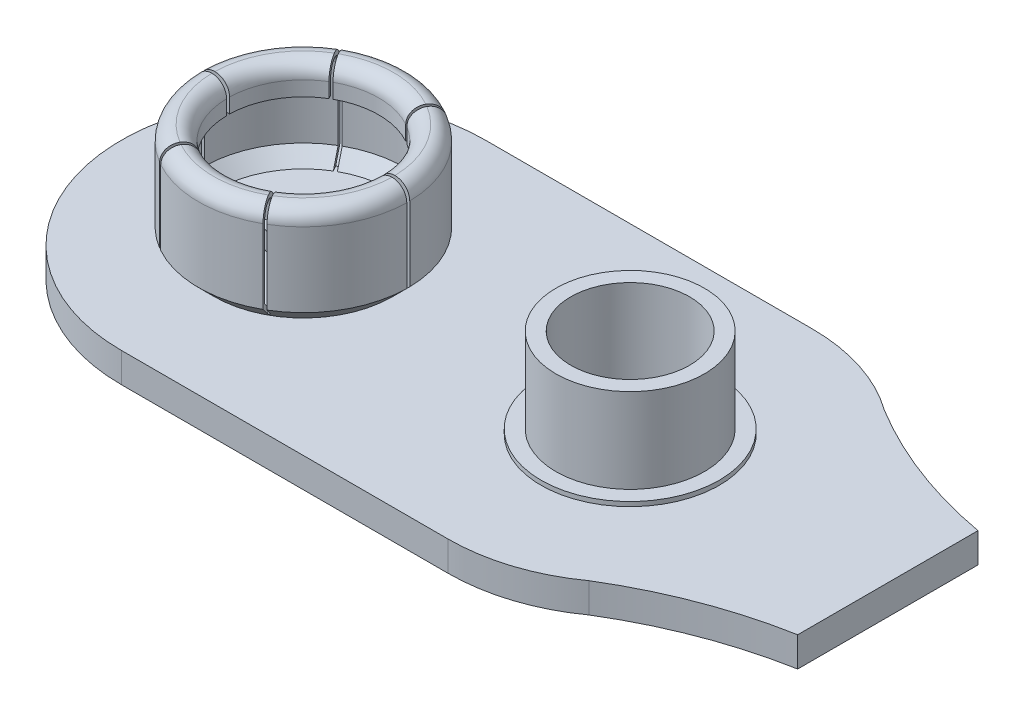
from build123d import *

# Parameters (mm, degrees)
SKETCH2_W           = 25
SKETCH2_H           = 16
BOSS_EXTRUDE1_DEPTH = 46
FILLET1_R           = 4
FILLET2_R           = 1
SKETCH3_R           = 2.5
SKETCH3_R_2         = 2
EXTRUDE_THIN1_DEPTH = 3
SKETCH6_R           = 1
BOSS_EXTRUDE2_DEPTH = 0.75
SKETCH10_W          = 1.5
SKETCH10_H          = 0.1
CUT_EXTRUDE1_DEPTH  = 49.477546349
CIRPATTERN1_COUNT   = 6
SKETCH11_R          = 3
BOSS_EXTRUDE3_DEPTH = 0.15
SKETCH12_W          = 40.346027398
SKETCH12_H          = 30.17682714
CUT_EXTRUDE2_DEPTH  = 46
BOSS_EXTRUDE4_DEPTH = 0.5
BOSS_EXTRUDE5_DEPTH = 0.5
BOSS_EXTRUDE6_DEPTH = 0.5


with BuildPart() as part:
    # Sketch2 → Boss-Extrude1 (new body)
    with BuildSketch(Plane(origin=(0, 0, 0), x_dir=(1, 0, 0), z_dir=(0, 1, 0))):
        Rectangle(SKETCH2_W, SKETCH2_H)
    extrude(amount=BOSS_EXTRUDE1_DEPTH)

    # Fillet1
    fillet1_edges = [part.edges().sort_by_distance(p)[0] for p in [
        (12.5, 23, 8),
        (-12.5, 23, 8),
        (-12.5, 23, -8),
        (12.5, 23, -8),
    ]]
    fillet(fillet1_edges, radius=FILLET1_R)

    # Fillet2
    fillet2_edges = [part.edges().sort_by_distance(p)[0] for p in [
        (-12.5, 0, 0),
        (-12.5, 46, 0),
        (12.5, 0, 0),
        (0, 0, 8),
        (0, 0, -8),
        (11.328427125, 0, 6.828427125),
        (11.328427125, 0, -6.828427125),
        (-11.328427125, 0, 6.828427125),
        (-11.328427125, 0, -6.828427125),
        (0, 46, -8),
        (12.5, 46, 0),
        (0, 46, 8),
        (11.328427125, 46, 6.828427125),
        (11.328427125, 46, -6.828427125),
        (-11.328427125, 46, 6.828427125),
        (-11.328427125, 46, -6.828427125),
    ]]
    fillet(fillet2_edges, radius=FILLET2_R)

    # Sketch3 → Extrude-Thin1 (add)
    with BuildSketch(Plane(origin=(0, 46, 0), x_dir=(1, 0, 0), z_dir=(0, 1, 0))):
        with Locations((5.5, 0)):
            Circle(SKETCH3_R)
        with Locations((5.5, 0)):
            Circle(SKETCH3_R_2, mode=Mode.SUBTRACT)
    extrude(amount=EXTRUDE_THIN1_DEPTH)

    # Sketch6 → Boss-Extrude2 (add)
    with BuildSketch(Plane(origin=(0, 46, 0), x_dir=(1, 0, 0), z_dir=(0, 1, 0))):
        with Locations(Location((-5.5, 0, 0), (0, 0, 90))):
            Circle(SKETCH6_R)
        with Locations(Location((5.5, 0, 0), (0, 0, 90))):
            Circle(SKETCH6_R)
    extrude(amount=BOSS_EXTRUDE2_DEPTH)

    # Sketch9 → Revolve-Thin1 (revolve)
    with BuildSketch(Plane.XY, mode=Mode.PRIVATE) as revolve_thin1_sk:
        with BuildLine():
            Line((-4.5, 46), (-2.5, 46))
            Line((-2.5, 46), (-1.969669914, 46.530330086))
            Line((-1.969669914, 46.530330086), (-1.969669914, 49.030330086))
            ThreePointArc((-1.969669914, 49.030330086), (-2.116202444, 49.381961465), (-2.469074773, 49.525479854))
            ThreePointArc((-2.469074773, 49.525479854), (-2.819198532, 49.380453844), (-2.964224541, 49.030330086))
            Line((-2.964224541, 49.030330086), (-2.964224541, 48.535180318))
            Line((-2.964224541, 48.535180318), (-2.814224541, 48.535180318))
            Line((-2.814224541, 48.535180318), (-2.814224541, 49.030330086))
            ThreePointArc((-2.814224541, 49.030330086), (-2.712905513, 49.274614618), (-2.468433015, 49.375479257))
            ThreePointArc((-2.468433015, 49.375479257), (-2.222041674, 49.27566845), (-2.119669914, 49.030330086))
            Line((-2.119669914, 49.030330086), (-2.119669914, 46.59246212))
            Line((-2.119669914, 46.59246212), (-2.562132034, 46.15))
            Line((-2.562132034, 46.15), (-4.5, 46.15))
            Line((-4.5, 46.15), (-4.5, 46))
        make_face()
    revolve(revolve_thin1_sk.sketch.rotate(Axis((-5.5, 46.75, 0), (0, -1, 0)), 90), axis=Axis((-5.5, 46.75, 0), (0, -1, 0)))

    # Sketch10 → Cut-Extrude1 (cut, through all)
    with BuildSketch(Plane(origin=(0, 46.15, 0), x_dir=(1, 0, 0), z_dir=(0, 1, 0))):
        with Locations((-2.469074773, 0)):
            Rectangle(SKETCH10_W, SKETCH10_H)
    cut_extrude1 = extrude(amount=CUT_EXTRUDE1_DEPTH, mode=Mode.SUBTRACT)

    # CirPattern1: Cut-Extrude1 ×6 about axis
    cirpattern1_axis = Axis((-5.5, 0, 0), (0, 1, 0))
    for i in range(1, CIRPATTERN1_COUNT):
        add(cut_extrude1.rotate(cirpattern1_axis, i * 360 / CIRPATTERN1_COUNT), mode=Mode.SUBTRACT)

    # Sketch11 → Boss-Extrude3 (add)
    with BuildSketch(Plane(origin=(0, 46, 0), x_dir=(1, 0, 0), z_dir=(0, 1, 0))):
        with Locations(Location((5.5, 0, 0), (0, 0, 90))):
            Circle(SKETCH11_R)
    extrude(amount=BOSS_EXTRUDE3_DEPTH)

    # Sketch12 → Cut-Extrude2 (cut)
    with BuildSketch(Plane.XZ):
        Rectangle(SKETCH12_W, SKETCH12_H)
    extrude(amount=-CUT_EXTRUDE2_DEPTH, mode=Mode.SUBTRACT)


with BuildPart() as cut_extrude2_piece_1:
    # of the separate pieces the step leaves, piece 1, a body of its own (cut_extrude2_pieces)
    add(part.part.solids().sort_by_distance((5.5, 46, -3))[0])



with BuildPart() as cut_extrude2_piece_2:
    # of the separate pieces the step leaves, piece 2, a body of its own (cut_extrude2_pieces)
    add(part.part.solids().sort_by_distance((-5.5, 46, 3))[0])


with BuildPart() as cut_extrude2_piece_1_1:
    add(cut_extrude2_piece_1.part)

    add(cut_extrude2_piece_2.part)  # Boss-Extrude4 merges Cut-Extrude2 piece 2
    # Sketch13 → Boss-Extrude4 (add)
    with BuildSketch(Plane.XZ.offset(-46)):
        with BuildLine():
            Line((-5.5, 6.129020264), (5.5, 6.129020264))
            ThreePointArc((5.5, 6.129020264), (11.629020264, 0), (5.5, -6.129020264))
            Line((5.5, -6.129020264), (-5.5, -6.129020264))
            ThreePointArc((-5.5, -6.129020264), (-11.629020264, 0), (-5.5, 6.129020264))
        make_face()
    extrude(amount=BOSS_EXTRUDE4_DEPTH)

    # Sketch14 → Boss-Extrude5 (add)
    with BuildSketch(Plane(origin=(0, 46, 0), x_dir=(1, 0, 0), z_dir=(0, 1, 0))):
        with BuildLine():
            Line((14.174152072, 0), (14.174152072, 3.03538247))
            ThreePointArc((14.174152072, 3.03538247), (11.539533022, 3.768470842), (9.083888456, 4.971984808))
            ThreePointArc((9.083888456, 4.971984808), (11.629020264, 0), (9.083888456, -4.971984808))
            ThreePointArc((9.083888456, -4.971984808), (11.539533022, -3.768470842), (14.174152072, -3.03538247))
            Line((14.174152072, -3.03538247), (14.174152072, 0))
        make_face()
    extrude(amount=-BOSS_EXTRUDE5_DEPTH)

    # Sketch15 → Boss-Extrude6 (add)
    with BuildSketch(Plane.XZ.offset(-45.5)):
        with BuildLine():
            Line((-5.5, -6.129020264), (5.5, -6.129020264))
            ThreePointArc((5.5, -6.129020264), (7.383015368, -5.832593121), (9.083888456, -4.971984808))
            ThreePointArc((9.083888456, -4.971984808), (11.539533022, -3.768470842), (14.174152072, -3.03538247))
            Line((14.174152072, -3.03538247), (14.174152072, 3.03538247))
            ThreePointArc((14.174152072, 3.03538247), (11.539533022, 3.768470842), (9.083888456, 4.971984808))
            ThreePointArc((9.083888456, 4.971984808), (7.383015368, 5.832593121), (5.5, 6.129020264))
            Line((5.5, 6.129020264), (-5.5, 6.129020264))
            ThreePointArc((-5.5, 6.129020264), (-11.629020264, 0), (-5.5, -6.129020264))
        make_face()
    extrude(amount=BOSS_EXTRUDE6_DEPTH)


solid = cut_extrude2_piece_1_1.part
